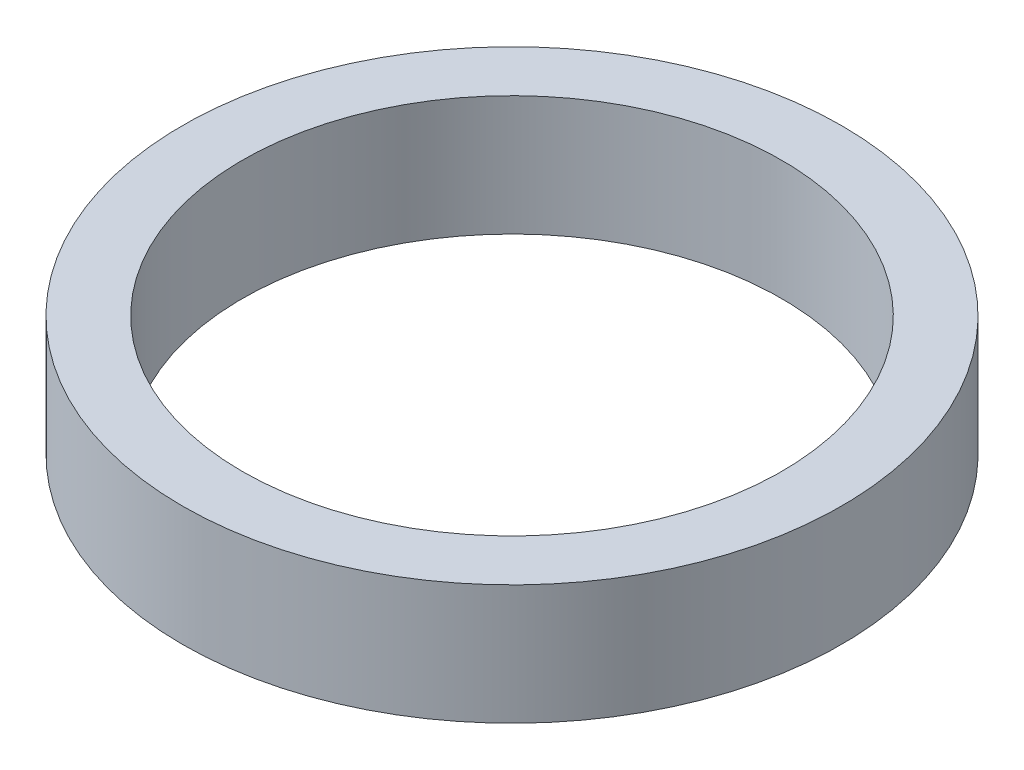
from build123d import *

# Parameters (mm, degrees)
SKETCH1_R           = 27.5
SKETCH1_R_2         = 22.5
BOSS_EXTRUDE1_DEPTH = 5


with BuildPart() as part:
    # Sketch1 → Boss-Extrude1 (new, symmetric)
    with BuildSketch(Plane(origin=(0, 0, 0), x_dir=(1, 0, 0), z_dir=(0, 1, 0))):
        with Locations(Location((0, 0, 0), (0, 0, 270))):
            Circle(SKETCH1_R)
        with Locations(Location((0, 0, 0), (0, 0, 270))):
            Circle(SKETCH1_R_2, mode=Mode.SUBTRACT)
    extrude(amount=BOSS_EXTRUDE1_DEPTH, both=True)


solid = part.part
